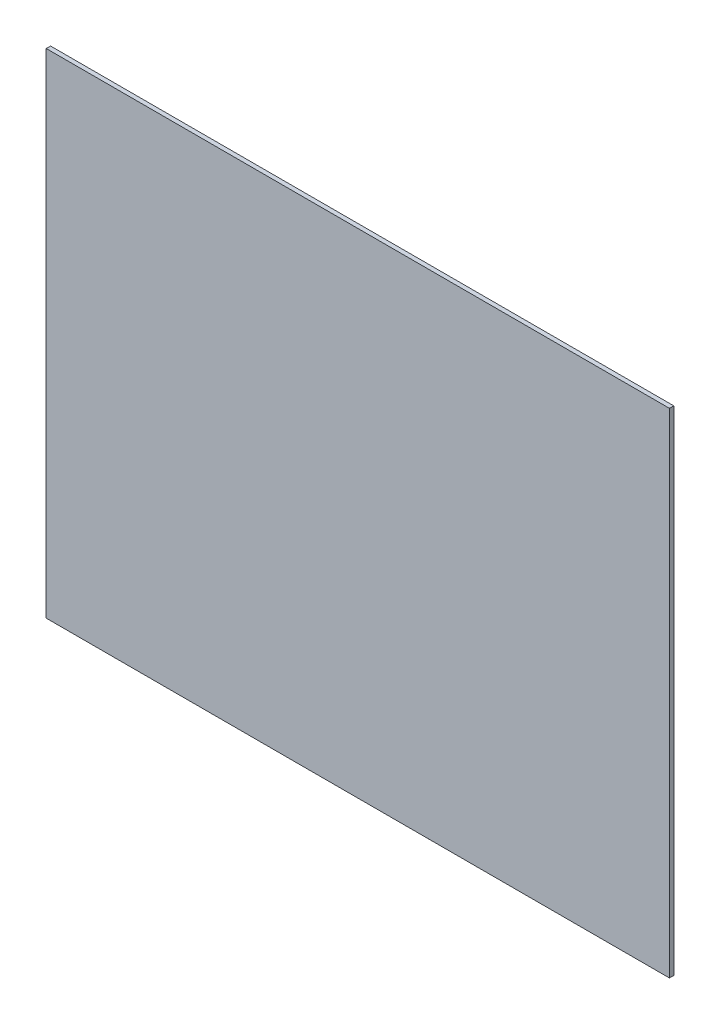
from build123d import *

# Parameters (mm, degrees)
SKETCH1_W           = 457.2
SKETCH1_H           = 361.95
BOSS_EXTRUDE1_DEPTH = 3.175


with BuildPart() as part:
    # Sketch1 → Boss-Extrude1 (new body)
    with BuildSketch(Plane.XY):
        with Locations((228.6, 180.975)):
            Rectangle(SKETCH1_W, SKETCH1_H)
    extrude(amount=BOSS_EXTRUDE1_DEPTH)


solid = part.part
